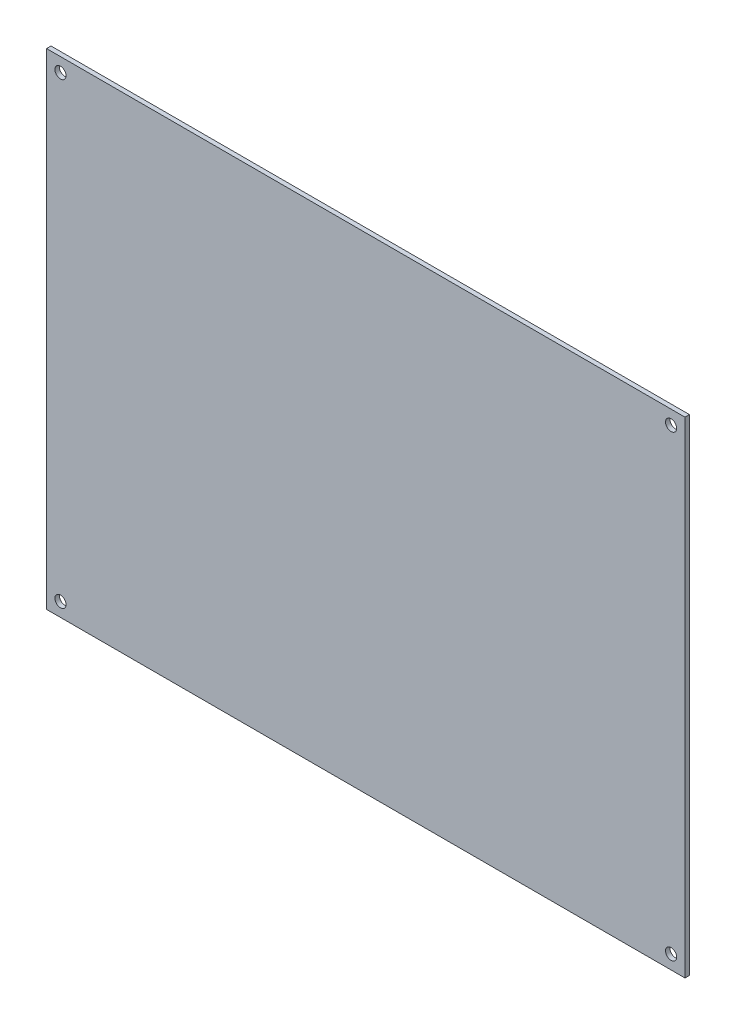
from build123d import *

# Parameters (mm, degrees)
SKETCH1_W           = 230
SKETCH1_H           = 175
SKETCH1_R           = 2
BOSS_EXTRUDE1_DEPTH = 1.6


with BuildPart() as part:
    # Sketch1 → Boss-Extrude1 (new body)
    with BuildSketch(Plane.XY):
        Rectangle(SKETCH1_W, SKETCH1_H)
        with Locations((110, 82.5)):
            Circle(SKETCH1_R, mode=Mode.SUBTRACT)
        with Locations(Location((110, -82.5, 0), (0, 0, 180))):
            Circle(SKETCH1_R, mode=Mode.SUBTRACT)
        with Locations((-110, -82.5)):
            Circle(SKETCH1_R, mode=Mode.SUBTRACT)
        with Locations(Location((-110, 82.5, 0), (0, 0, 180))):
            Circle(SKETCH1_R, mode=Mode.SUBTRACT)
    extrude(amount=BOSS_EXTRUDE1_DEPTH)


solid = part.part
